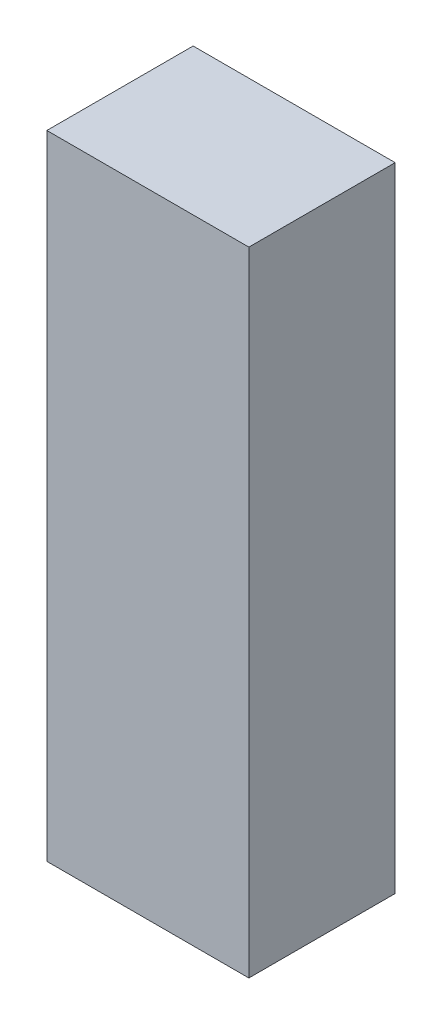
from build123d import *

# Parameters (mm, degrees)
SKETCH1_W           = 35.0774
SKETCH1_H           = 25.4
BOSS_EXTRUDE1_DEPTH = 109.9058


with BuildPart() as part:
    # Sketch1 → Boss-Extrude1 (new body)
    with BuildSketch(Plane(origin=(0, 0, 0), x_dir=(1, 0, 0), z_dir=(0, 1, 0))):
        Rectangle(SKETCH1_W, SKETCH1_H)
    extrude(amount=BOSS_EXTRUDE1_DEPTH)


solid = part.part
